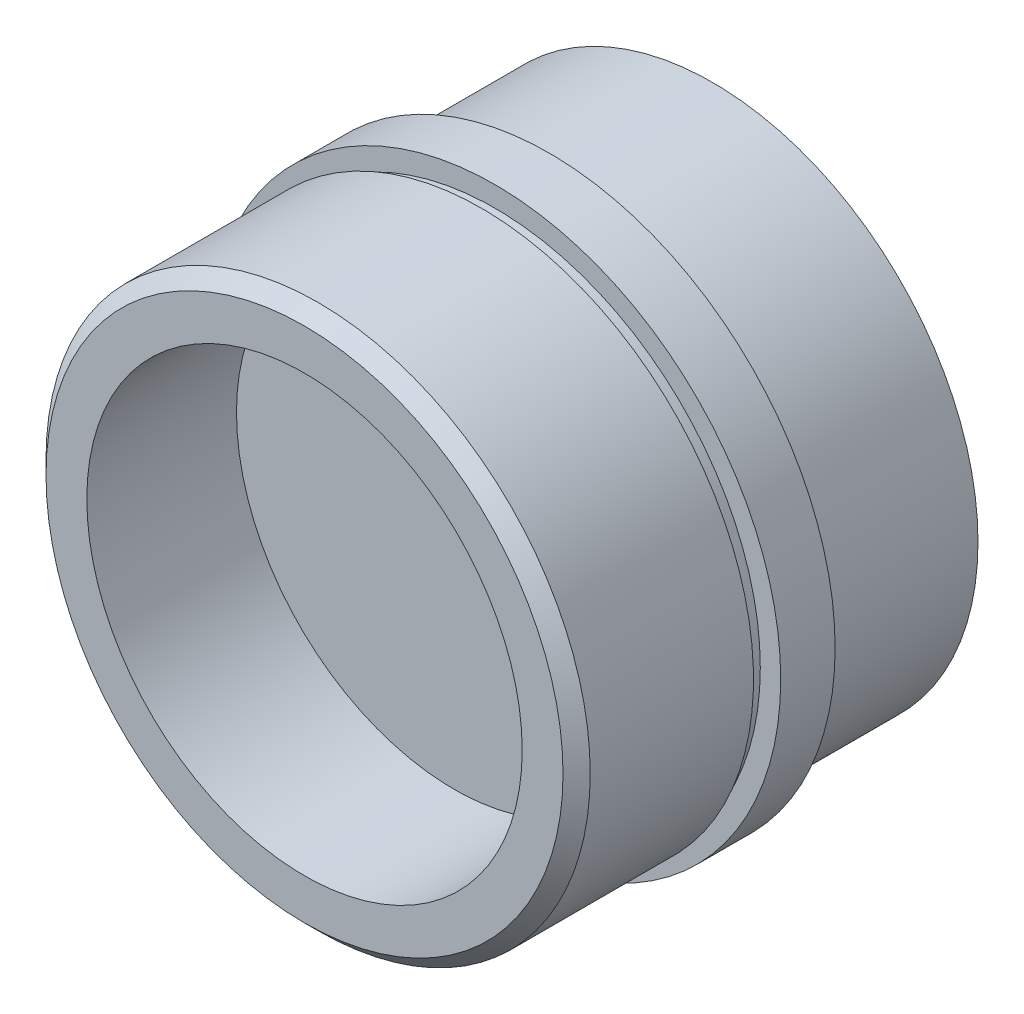
from build123d import *

# Parameters (mm, degrees)
SKETCH_1_R          = 19.5
SKETCH_1_R_2        = 16
EXTRUDE_1_DEPTH     = 12
SKETCH_2_R          = 21
SKETCH_2_R_2        = 16
EXTRUDE_2_DEPTH     = 4
SKETCH_3_R          = 20
EXTRUDE_3_DEPTH     = 3
SKETCH_4_R          = 20
SKETCH_4_R_2        = 16
EXTRUDE_4_DEPTH     = 14
SKETCH_6_R          = 20
SKETCH_6_R_2        = 19
CUT_EXTRUDE_1_DEPTH = 1.5
CUT_EXTRUDE_START   = -3
SKETCH_7_R          = 20
CUT_EXTRUDE_2_DEPTH = 3
CHAMFER_1_SIZE      = 1
SKETCH_8_W          = 0.5
SKETCH_8_H          = 1


with BuildPart() as part:
    # 草图1 → 拉伸1 (new body)
    with BuildSketch(Plane.XY):
        Circle(SKETCH_1_R)
        Circle(SKETCH_1_R_2, mode=Mode.SUBTRACT)
    extrude(amount=EXTRUDE_1_DEPTH)

    # 草图2 → 拉伸2 (add)
    with BuildSketch(Plane.XY.offset(12)):
        Circle(SKETCH_2_R)
        Circle(SKETCH_2_R_2, mode=Mode.SUBTRACT)
    extrude(amount=EXTRUDE_2_DEPTH)

    # 草图3 → 拉伸3 (add)
    with BuildSketch(Plane.XY.offset(16)):
        Circle(SKETCH_3_R)
    extrude(amount=EXTRUDE_3_DEPTH)

    # 草图4 → 拉伸4 (add)
    with BuildSketch(Plane.XY.offset(19)):
        Circle(SKETCH_4_R)
        Circle(SKETCH_4_R_2, mode=Mode.SUBTRACT)
    extrude(amount=EXTRUDE_4_DEPTH)

    # 草图6 → 切除-拉伸1 (cut)
    with BuildSketch(Plane.XY.offset(30)):
        Circle(SKETCH_6_R)
        Circle(SKETCH_6_R_2, mode=Mode.SUBTRACT)
    extrude(amount=CUT_EXTRUDE_1_DEPTH, mode=Mode.SUBTRACT)

    # 草图7 → 切除-拉伸2 (cut)
    with BuildSketch(Plane.XY.offset(33).offset(CUT_EXTRUDE_START)):
        Circle(SKETCH_7_R)
    extrude(amount=CUT_EXTRUDE_2_DEPTH, mode=Mode.SUBTRACT)

    # 倒角1
    chamfer_1_edges = [part.edges().sort_by_distance(p)[0] for p in [
        (-20, 0, 30),
    ]]
    chamfer(chamfer_1_edges, length=CHAMFER_1_SIZE)

    # 草图8 → 切除-旋转1 (revolve, cut)
    with BuildSketch(Plane(origin=(0, 0, 0), x_dir=(1, 0, 0), z_dir=(0, 1, 0))):
        with Locations((-19.75, -16.5)):
            Rectangle(SKETCH_8_W, SKETCH_8_H)
    revolve(axis=Axis((0, 0, 0), (0, 0, 1)), mode=Mode.SUBTRACT)


solid = part.part
